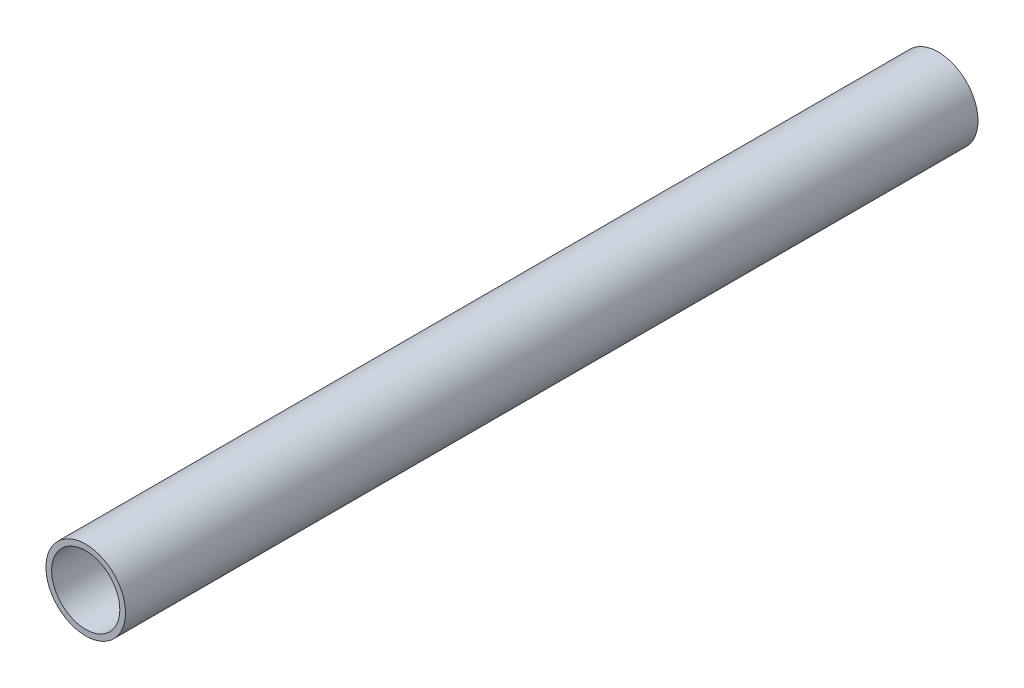
from build123d import *

# Parameters (mm, degrees)
SKETCH_1_R       = 7
SKETCH_1_R_2     = 6
EXTRUDE_12_DEPTH = 150


with BuildPart() as part:
    # Эскиз1 → Трубка алюминиевая 12мм (new body)
    with BuildSketch(Plane.XY):
        Circle(SKETCH_1_R)
        Circle(SKETCH_1_R_2, mode=Mode.SUBTRACT)
    extrude(amount=EXTRUDE_12_DEPTH)


solid = part.part
